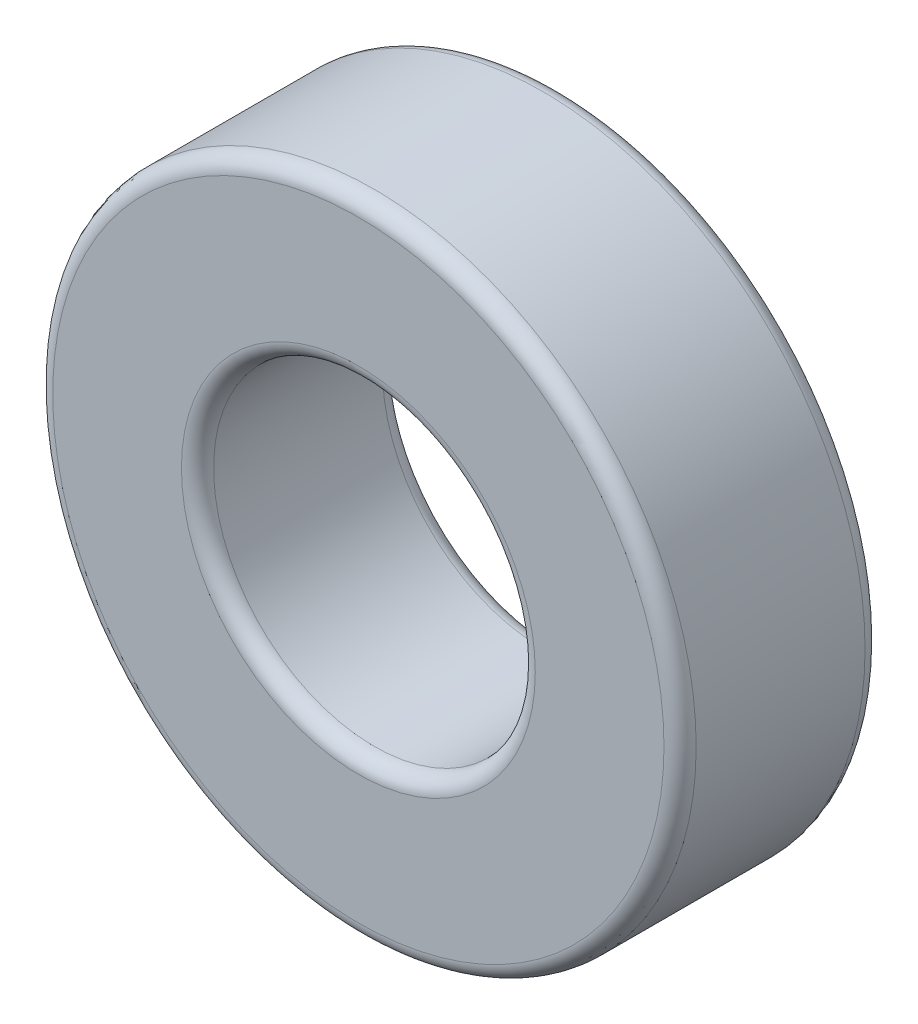
from build123d import *

# Parameters (mm, degrees)
ESQUISSE1_R      = 4
ESQUISSE1_R_2    = 2
EXTRUSION1_DEPTH = 2.5
CONG_1_R         = 0.2


with BuildPart() as part:
    # Esquisse1 → Extrusion1 (new body)
    with BuildSketch(Plane.XY):
        Circle(ESQUISSE1_R)
        Circle(ESQUISSE1_R_2, mode=Mode.SUBTRACT)
    extrude(amount=EXTRUSION1_DEPTH)

    # Congé1
    cong_1_edges = [part.edges().sort_by_distance(p)[0] for p in [
        (-4, 0, 0),
        (-4, 0, 2.5),
        (-2, 0, 0),
        (-2, 0, 2.5),
    ]]
    fillet(cong_1_edges, radius=CONG_1_R)


solid = part.part
